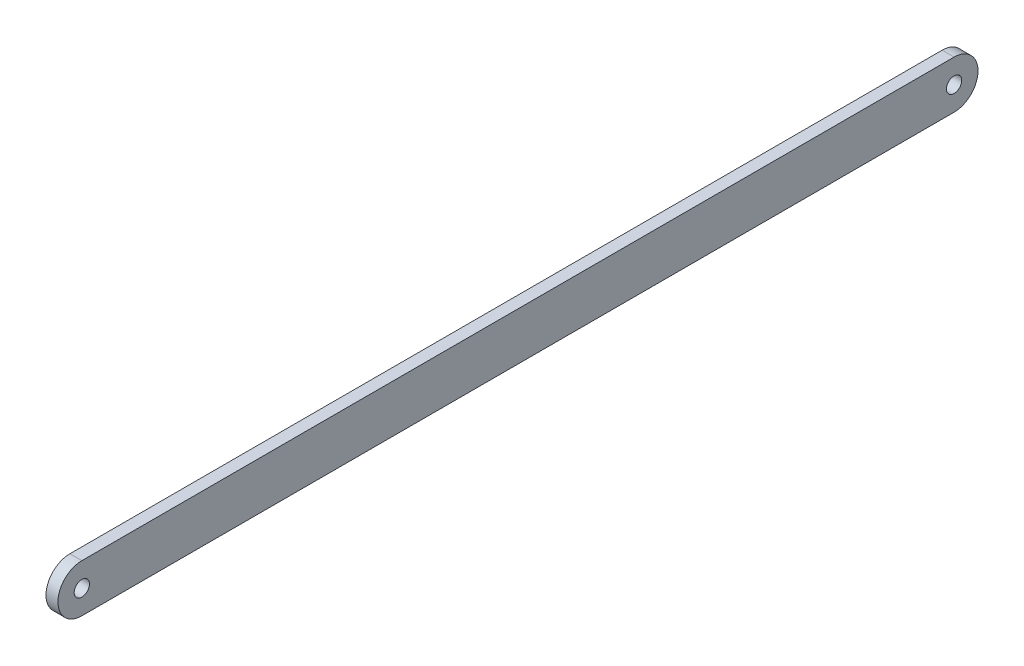
from build123d import *

# Parameters (mm, degrees)
SKETCH1_R           = 2.032
BOSS_EXTRUDE1_DEPTH = 3.175


with BuildPart() as part:
    # Sketch1 → Boss-Extrude1 (new body)
    with BuildSketch(Plane(origin=(0, 0, 0), x_dir=(0, 0, -1), z_dir=(1, 0, 0))):
        with BuildLine():
            Line((0, -6.35), (-231.775, -6.35))
            ThreePointArc((-231.775, -6.35), (-238.125, 0), (-231.775, 6.35))
            Line((-231.775, 6.35), (0, 6.35))
            ThreePointArc((0, 6.35), (6.35, 0), (0, -6.35))
        make_face()
        with Locations((-231.775, 0)):
            Circle(SKETCH1_R, mode=Mode.SUBTRACT)
        Circle(SKETCH1_R, mode=Mode.SUBTRACT)
    extrude(amount=BOSS_EXTRUDE1_DEPTH)


solid = part.part
